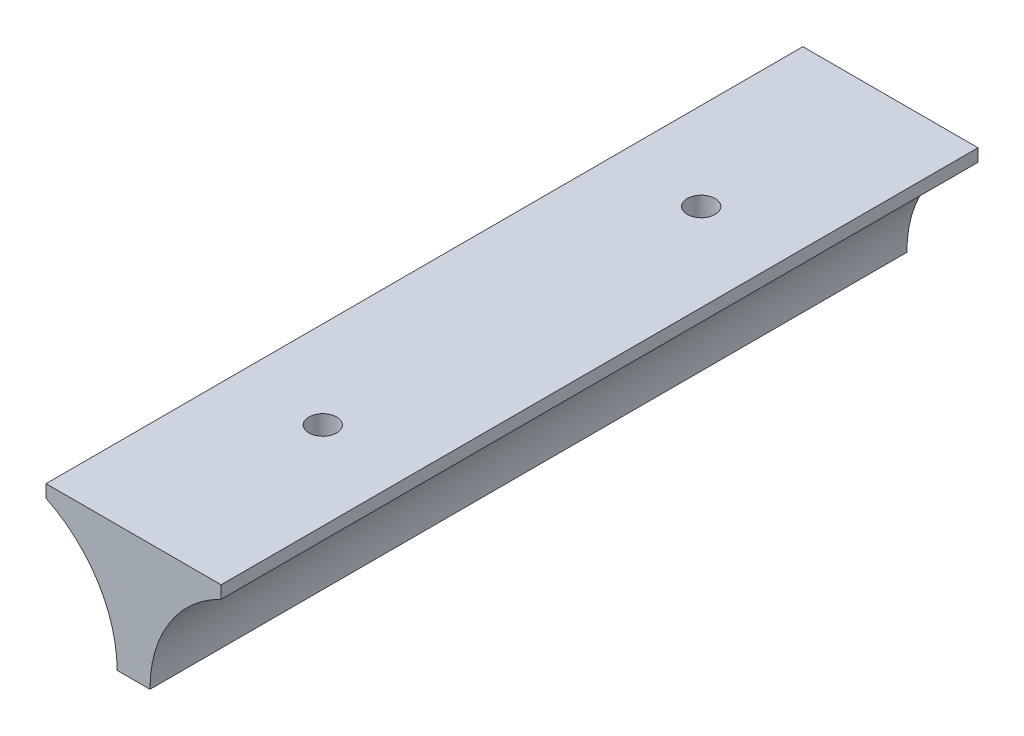
from build123d import *

# Parameters (mm, degrees)
BOSS_EXTRUDE1_DEPTH        = 30
F_2_2_2_2_DIAMETER_HOLE1_D = 2.2


with BuildPart() as part:
    # Sketch1 → Boss-Extrude1 (new, symmetric)
    with BuildSketch(Plane.XY):
        with BuildLine():
            Line((-1.3, 0), (1.3, 0))
            ThreePointArc((1.3, 0), (2.826836794, 5.310885546), (6.941101056, 9))
            Line((6.941101056, 9), (6.941101056, 10))
            Line((6.941101056, 10), (-6.941101056, 10))
            Line((-6.941101056, 10), (-6.941101056, 9))
            ThreePointArc((-6.941101056, 9), (-2.826836794, 5.310885546), (-1.3, 0))
        make_face()
    extrude(amount=BOSS_EXTRUDE1_DEPTH, both=True)

    # Ø2.2 (2.2) Diameter Hole1 (through all)
    with Locations(Plane(origin=(0, 10, 15), x_dir=(0, 0, 1), z_dir=(0, 1, 0))):
        with Locations((0, 0), (-30, 0)):
            Hole(F_2_2_2_2_DIAMETER_HOLE1_D / 2)


solid = part.part
